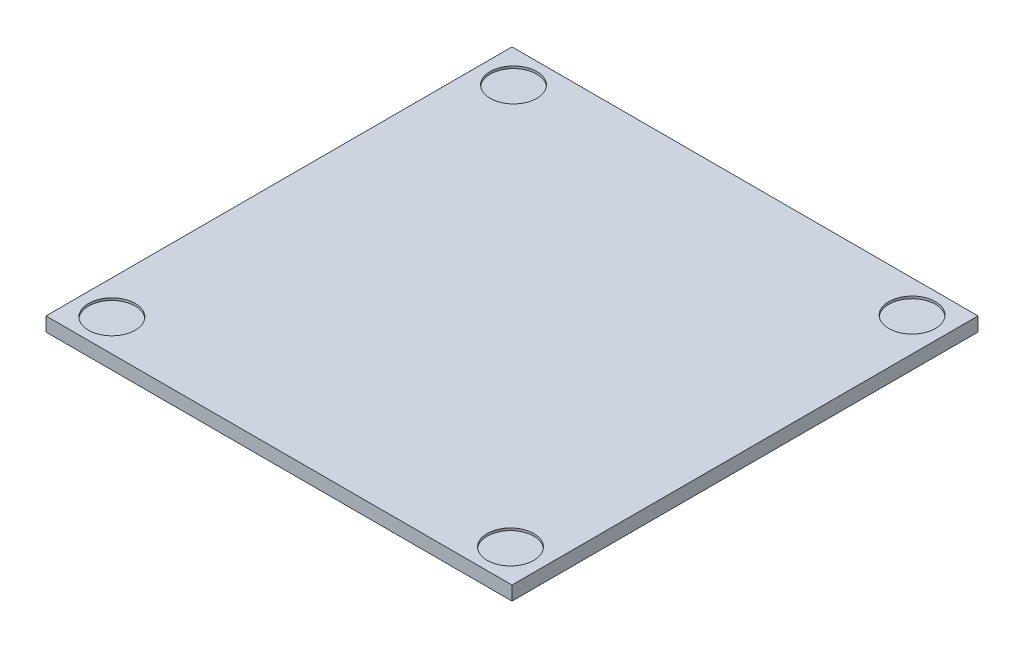
from build123d import *

# Parameters (mm, degrees)
SKETCH1_W           = 1000
SKETCH1_H           = 1000
BOSS_EXTRUDE1_DEPTH = 30
SKETCH2_R           = 50
CUT_EXTRUDE1_DEPTH  = 5


with BuildPart() as part:
    # Sketch1 → Boss-Extrude1 (new body)
    with BuildSketch(Plane(origin=(0, 0, 0), x_dir=(1, 0, 0), z_dir=(0, 1, 0))):
        with Locations((500, -500)):
            Rectangle(SKETCH1_W, SKETCH1_H)
    extrude(amount=BOSS_EXTRUDE1_DEPTH)

    # Sketch2 → Cut-Extrude1 (cut)
    with BuildSketch(Plane(origin=(0, 30, 0), x_dir=(1, 0, 0), z_dir=(0, 1, 0))):
        with Locations(Location((72.315618364, -69.06845402, 0), (0, 0, 270))):
            Circle(SKETCH2_R)
        with Locations(Location((927.684381636, -69.06845402, 0), (0, 0, 90))):
            Circle(SKETCH2_R)
        with Locations(Location((927.684381636, -930.93154598, 0), (0, 0, 270))):
            Circle(SKETCH2_R)
        with Locations(Location((72.315618364, -930.93154598, 0), (0, 0, 90))):
            Circle(SKETCH2_R)
    extrude(amount=-CUT_EXTRUDE1_DEPTH, mode=Mode.SUBTRACT)


solid = part.part
